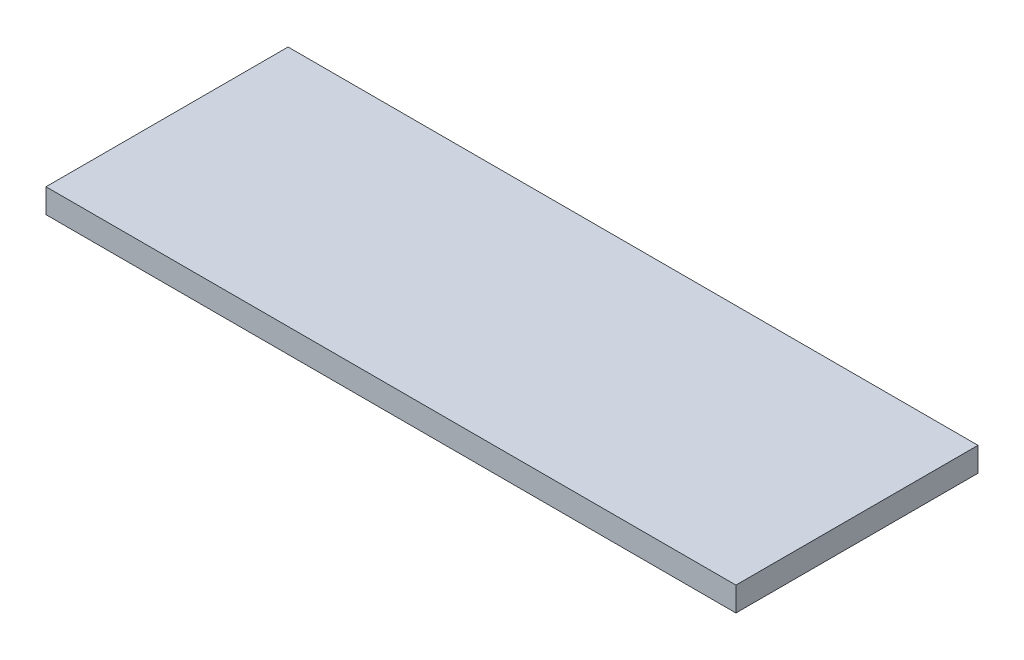
from build123d import *

# Parameters (mm, degrees)
SKETCH1_W             = 28.5
SKETCH1_H             = 10
BOSS_EXTRUDE1_DEPTH   = 1
BODY_MOVE_COPY1_ANGLE = 90


with BuildPart() as part:
    # Sketch1 → Boss-Extrude1 (new body)
    with BuildSketch(Plane.XY):
        with Locations((-1.561111111, 15.105555556)):
            Rectangle(SKETCH1_W, SKETCH1_H)
    extrude(amount=BOSS_EXTRUDE1_DEPTH)


with BuildPart() as part_1:
    # Body-Move/Copy1: moved
    add(part.part.rotate(Axis((0, 15.105555556, 0.25), (1, 0, 0)), BODY_MOVE_COPY1_ANGLE))


solid = part_1.part
